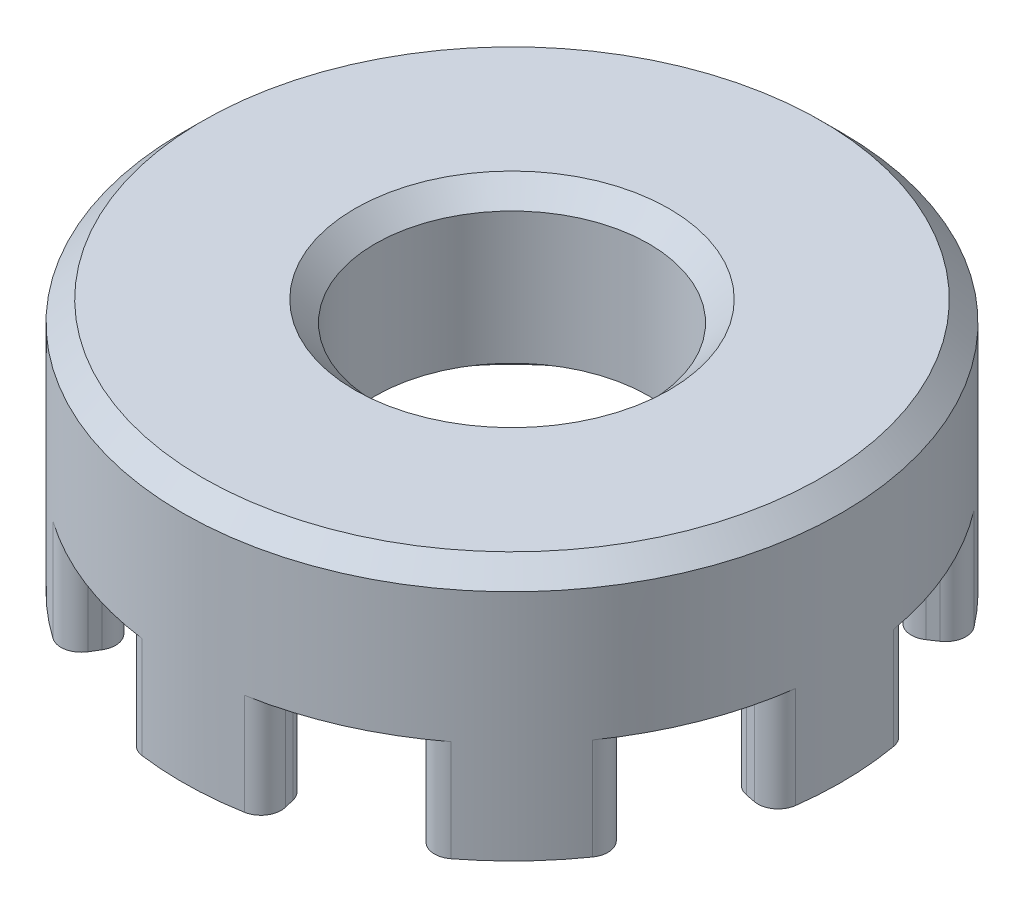
from build123d import *

# Parameters (mm, degrees)
SKETCH1_R           = 6.5
SKETCH1_R_2         = 2.7
BOSS_EXTRUDE1_DEPTH = 3
BOSS_EXTRUDE2_START = -2
SKETCH1_3_R         = 6.5
SKETCH1_3_R_2       = 5.5
BOSS_EXTRUDE2_DEPTH = 2
CUT_EXTRUDE1_DEPTH  = 2
CIRPATTERN1_COUNT   = 8
FILLET2_R           = 0.4
CHAMFER1_SIZE       = 0.4


with BuildPart() as part:
    # Sketch1 → Boss-Extrude1 (new body)
    with BuildSketch(Plane(origin=(0, 0, 0), x_dir=(1, 0, 0), z_dir=(0, 1, 0))):
        Circle(SKETCH1_R)
        Circle(SKETCH1_R_2, mode=Mode.SUBTRACT)
    extrude(amount=BOSS_EXTRUDE1_DEPTH)

    # Sketch1<3> → Boss-Extrude2 (add)
    with BuildSketch(Plane(origin=(0, 0, 0), x_dir=(1, 0, 0), z_dir=(0, 1, 0)).offset(BOSS_EXTRUDE2_START)):
        Circle(SKETCH1_3_R)
        Circle(SKETCH1_3_R_2, mode=Mode.SUBTRACT)
    extrude(amount=BOSS_EXTRUDE2_DEPTH)

    # Sketch2 → Cut-Extrude1 (cut)
    with BuildSketch(Plane(origin=(0, -2, 0), x_dir=(-1, 0, 0), z_dir=(0, -1, 0))):
        Polygon((0, 0), (3.374998796, -5.555122242), (3.374998796, -6.374424951), (1.271497758, -6.374424951), align=None)
    cut_extrude1 = extrude(amount=-CUT_EXTRUDE1_DEPTH, mode=Mode.SUBTRACT)

    # CirPattern1: Cut-Extrude1 ×8 about axis
    cirpattern1_axis = Axis((0, 3, 0), (0, -1, 0))
    for i in range(1, CIRPATTERN1_COUNT):
        add(cut_extrude1.rotate(cirpattern1_axis, i * 360 / CIRPATTERN1_COUNT), mode=Mode.SUBTRACT)

    # Fillet2
    fillet2_edges = [part.edges().sort_by_distance(p)[0] for p in [
        (6.314549143, -1, -1.541580072),
        (5.406483796, -1, -3.608314421),
        (3.374998796, -1, -5.555122242),
        (1.271497758, -1, -6.374424951),
        (-1.541580072, -1, -6.314549143),
        (-3.608314421, -1, -5.406483796),
        (-5.555122242, -1, -3.374998796),
        (-6.374424951, -1, -1.271497758),
        (-6.314549143, -1, 1.541580072),
        (-5.406483796, -1, 3.608314421),
        (-3.374998796, -1, 5.555122242),
        (-1.271497758, -1, 6.374424951),
        (1.541580072, -1, 6.314549143),
        (3.608314421, -1, 5.406483796),
        (5.555122242, -1, 3.374998796),
        (6.374424951, -1, 1.271497758),
        (2.855768212, -1, -4.700488051),
        (4.574717058, -1, -3.053189126),
        (5.343080044, -1, -1.304413907),
        (5.393744189, -1, 1.075882719),
        (4.700488051, -1, 2.855768212),
        (3.053189126, -1, 4.574717058),
        (1.304413907, -1, 5.343080044),
        (-1.075882719, -1, 5.393744189),
        (-2.855768212, -1, 4.700488051),
        (-4.574717058, -1, 3.053189126),
        (-5.343080044, -1, 1.304413907),
        (-5.393744189, -1, -1.075882719),
        (-4.700488051, -1, -2.855768212),
        (-3.053189126, -1, -4.574717058),
        (1.075882719, -1, -5.393744189),
        (-1.304413907, -1, -5.343080044),
    ]]
    fillet(fillet2_edges, radius=FILLET2_R)

    # Chamfer1
    chamfer1_edges = [part.edges().sort_by_distance(p)[0] for p in [
        (-6.5, 3, 0),
        (-2.7, 3, 0),
    ]]
    chamfer(chamfer1_edges, length=CHAMFER1_SIZE)


solid = part.part
